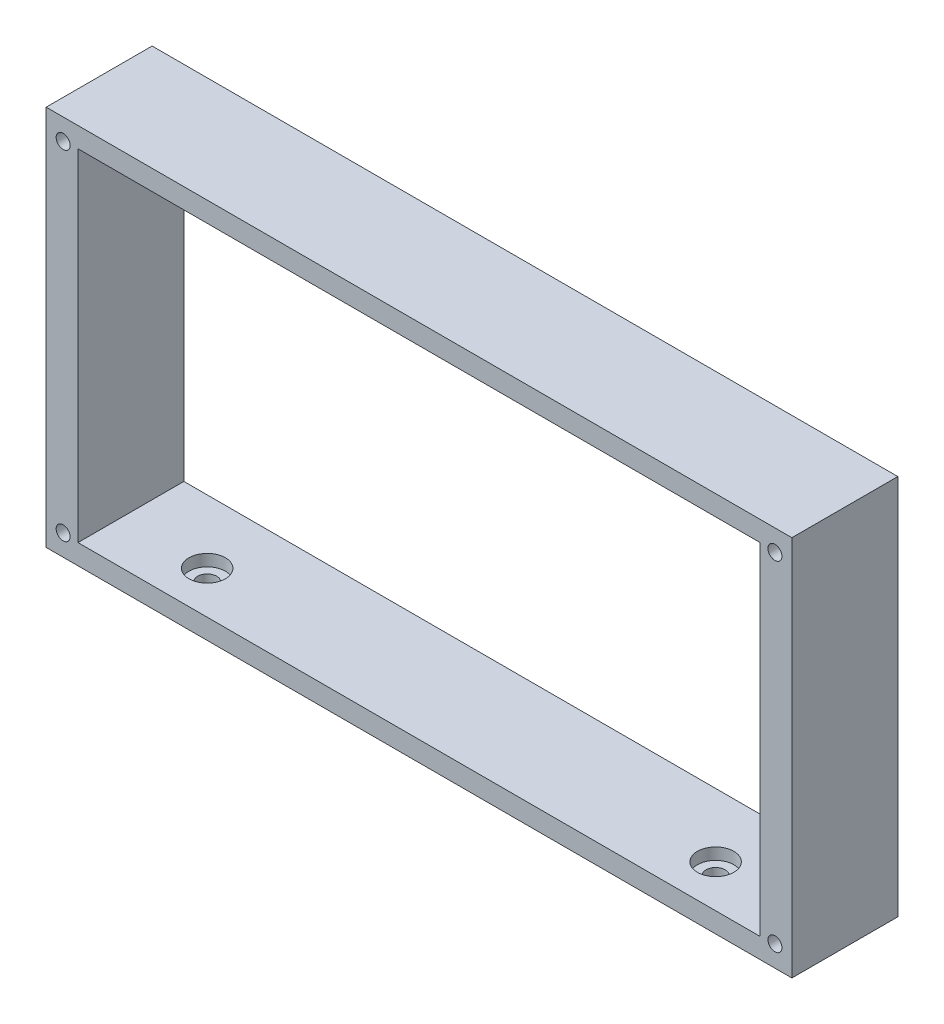
from build123d import *

# Parameters (mm, degrees)
SKETCH5_W                       = 176
SKETCH5_H                       = 90
SKETCH5_W_2                     = 161
SKETCH5_H_2                     = 80.5
BOSS_EXTRUDE2_DEPTH             = 25
M4X0_7_TAPPED_HOLE1_D           = 3.3
CBORE_FOR_M4_SBHCS1_D           = 4.5
CBORE_FOR_M4_SBHCS1_DEPTH       = 4.75
CBORE_FOR_M4_SBHCS1_CBORE_D     = 8.6
CBORE_FOR_M4_SBHCS1_CBORE_DEPTH = 2.75
M4X0_7_TAPPED_HOLE2_D           = 3.3
M4X0_7_TAPPED_HOLE2_DEPTH       = 5
M4X0_7_TAPPED_HOLE2_TIP         = 0.991420021


with BuildPart() as part:
    # Sketch5 → Boss-Extrude2 (new body)
    with BuildSketch(Plane.XY):
        Rectangle(SKETCH5_W, SKETCH5_H)
        Rectangle(SKETCH5_W_2, SKETCH5_H_2, mode=Mode.SUBTRACT)
    extrude(amount=BOSS_EXTRUDE2_DEPTH)

    # M4x0.7 Tapped Hole1 (through all)
    with Locations(Plane(origin=(0, 0, 0), x_dir=(-1, 0, 0), z_dir=(0, 0, -1))):
        with Locations((0, 0), (84, 40), (-84, -40), (-84, 40), (84, -40)):
            Hole(M4X0_7_TAPPED_HOLE1_D / 2)

    # CBORE for M4 SBHCS1
    with Locations(Plane(origin=(0, -40.25, 0), x_dir=(1, 0, 0), z_dir=(0, 1, 0))):
        with Locations((-60, -15), (60, -15)):
            CounterBoreHole(CBORE_FOR_M4_SBHCS1_D / 2, CBORE_FOR_M4_SBHCS1_CBORE_D / 2, CBORE_FOR_M4_SBHCS1_CBORE_DEPTH, depth=CBORE_FOR_M4_SBHCS1_DEPTH)

    # M4x0.7 Tapped Hole2
    with Locations(Plane(origin=(0, 0, 0), x_dir=(-1, 0, 0), z_dir=(0, 0, -1))):
        with Locations((0, 0), (10, 42.5), (-10, -42.5), (-10, 42.5), (10, -42.5)):
            Hole(M4X0_7_TAPPED_HOLE2_D / 2, depth=M4X0_7_TAPPED_HOLE2_DEPTH)
            with Locations((0, 0, -(M4X0_7_TAPPED_HOLE2_DEPTH + M4X0_7_TAPPED_HOLE2_TIP / 2))):  # 118° drill point
                Cone(0, M4X0_7_TAPPED_HOLE2_D / 2, M4X0_7_TAPPED_HOLE2_TIP, mode=Mode.SUBTRACT)


solid = part.part
